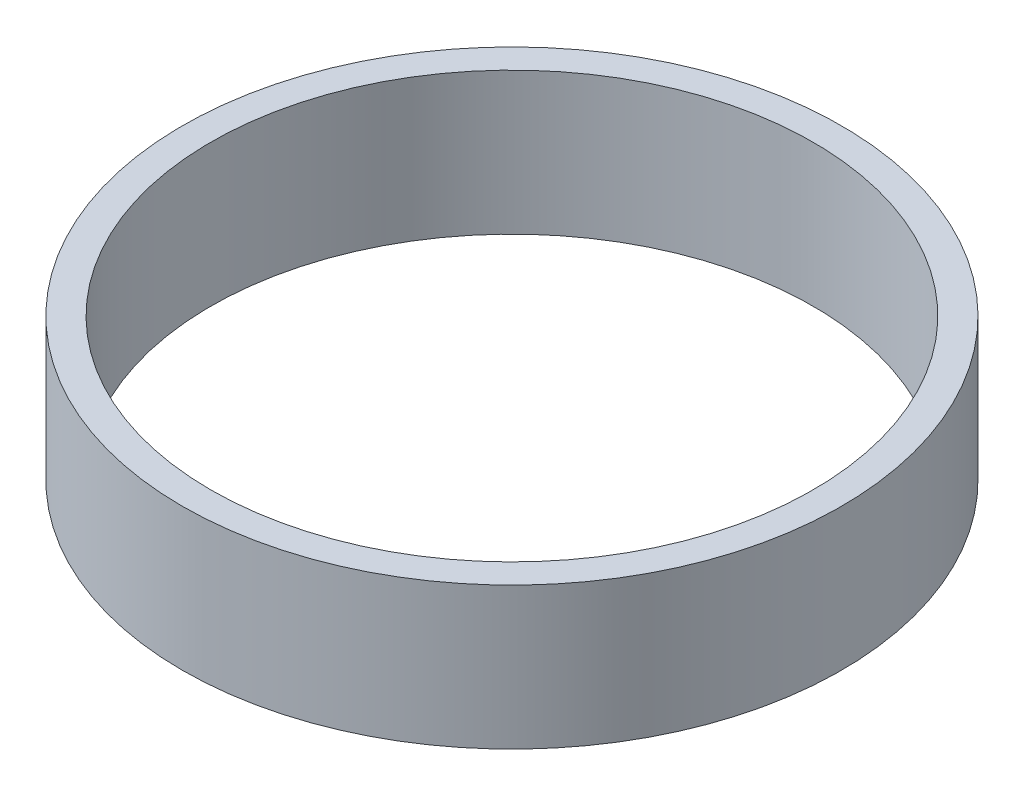
from build123d import *

# Parameters (mm, degrees)
SKETCH_1_R        = 11.6
SKETCH_1_R_2      = 10.6
EXTRUDE_302_DEPTH = 5


with BuildPart() as part:
    # Эскиз1 → Extrude 302 (new body)
    with BuildSketch(Plane(origin=(0, 0, 0), x_dir=(1, 0, 0), z_dir=(0, 1, 0))):
        with Locations(Location((0, 0, 0), (0, 0, 270))):
            Circle(SKETCH_1_R)
        with Locations(Location((0, 0, 0), (0, 0, 270))):
            Circle(SKETCH_1_R_2, mode=Mode.SUBTRACT)
    extrude(amount=EXTRUDE_302_DEPTH)


solid = part.part
